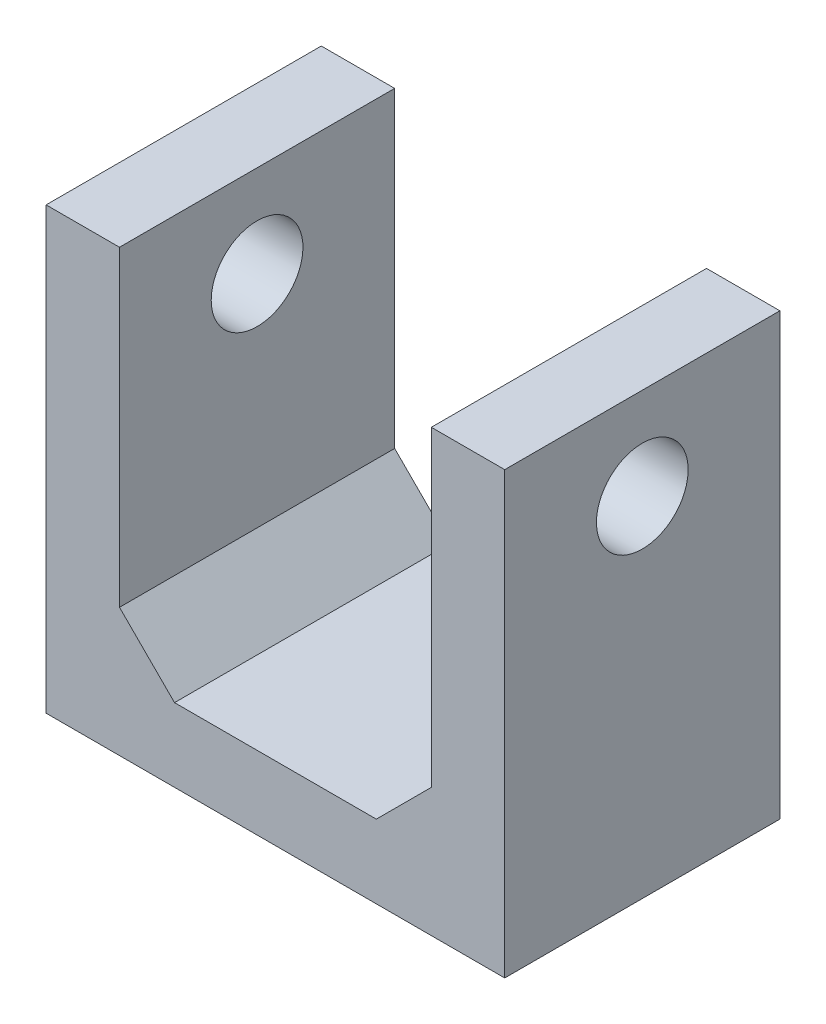
from build123d import *

# Parameters (mm, degrees)
BOSS_EXTRUDE1_DEPTH = 15
CHAMFER1_SIZE       = 3
CHAMFER2_SIZE       = 3
SKETCH2_R           = 2.5
CUT_EXTRUDE1_DEPTH  = 37
SKETCH3_R           = 1.5
CUT_EXTRUDE2_DEPTH  = 6


with BuildPart() as part:
    # Sketch1 → Boss-Extrude1 (new body)
    with BuildSketch(Plane.XY):
        Polygon((8.117882489, 6.249295775), (12.117882489, 6.249295775), (12.117882489, -17.750704225), (-12.882117511, -17.750704225), (-12.882117511, 6.249295775), (-8.882117511, 6.249295775), (-8.882117511, -13.750704225), (8.117882489, -13.750704225), align=None)
    extrude(amount=BOSS_EXTRUDE1_DEPTH)

    # Chamfer1
    chamfer1_edges = [part.edges().sort_by_distance(p)[0] for p in [
        (-8.882117511, -13.750704225, 7.5),
    ]]
    chamfer(chamfer1_edges, length=CHAMFER1_SIZE)

    # Chamfer2
    chamfer2_edges = [part.edges().sort_by_distance(p)[0] for p in [
        (8.117882489, -13.750704225, 7.5),
    ]]
    chamfer(chamfer2_edges, length=CHAMFER2_SIZE)

    # Sketch2 → Cut-Extrude1 (cut)
    with BuildSketch(Plane.ZY.offset(12.882117511)):
        with Locations(Location((7.5, 1.249295775, 0), (0, 0, 90))):
            Circle(SKETCH2_R)
    extrude(amount=-CUT_EXTRUDE1_DEPTH, mode=Mode.SUBTRACT)

    # Sketch3 → Cut-Extrude2 (cut)
    with BuildSketch(Plane.XZ.offset(17.750704225)):
        with Locations(Location((-9.882117511, 12, 0), (0, 0, 270))):
            Circle(SKETCH3_R)
        with Locations(Location((-9.882117511, 3, 0), (0, 0, 90))):
            Circle(SKETCH3_R)
        with Locations(Location((9.117882489, 12, 0), (0, 0, 90))):
            Circle(SKETCH3_R)
        with Locations(Location((9.117882489, 3, 0), (0, 0, 270))):
            Circle(SKETCH3_R)
    extrude(amount=-CUT_EXTRUDE2_DEPTH, mode=Mode.SUBTRACT)


solid = part.part
